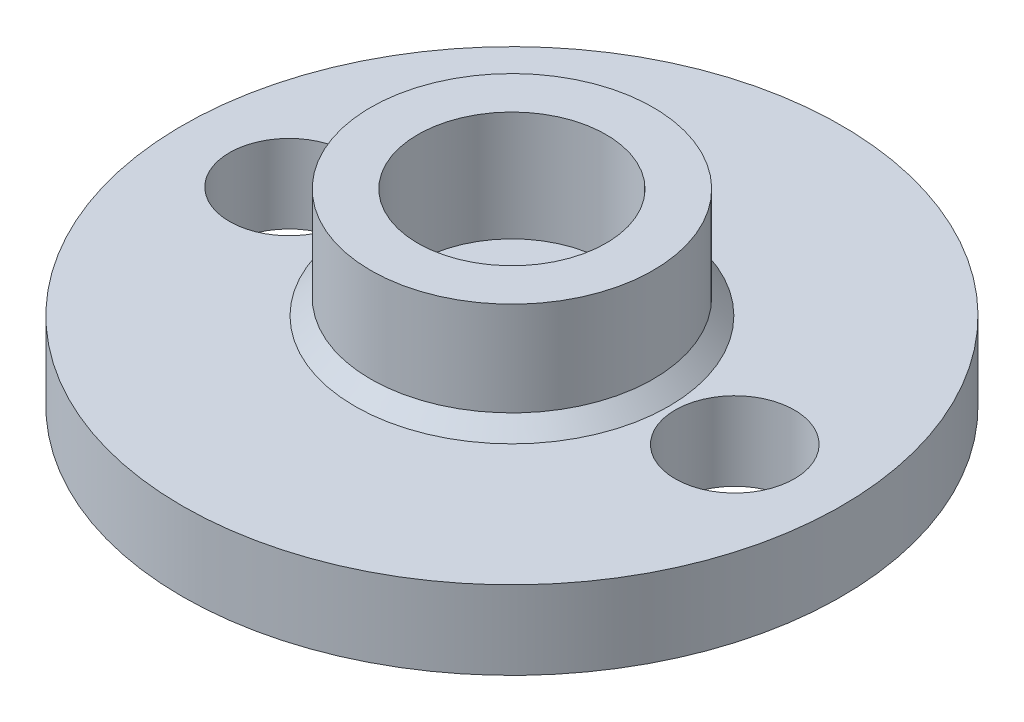
from build123d import *

# Parameters (mm, degrees)
SKETCH1_R               = 10.5
BOSS_EXTRUDE1_DEPTH     = 2.5
SKETCH2_R               = 4.5
SKETCH2_R_2             = 3
BOSS_EXTRUDE2_DEPTH     = 3.5
SKETCH4_R               = 1.5
CUT_EXTRUDE1_DEPTH      = 3.5
CUT_EXTRUDE2_DEPTH      = 16.256146302
CUT_EXTRUDE2_DEPTH_BACK = 16.256146302
SKETCH5_R               = 1.9
CHAMFER1_SIZE           = 0.5


with BuildPart() as part:
    # Sketch1 → Boss-Extrude1 (new body)
    with BuildSketch(Plane(origin=(0, 0, 0), x_dir=(1, 0, 0), z_dir=(0, 1, 0))):
        with Locations(Location((0, 0, 0), (0, 0, 270))):
            Circle(SKETCH1_R)
    extrude(amount=BOSS_EXTRUDE1_DEPTH)

    # Sketch2 → Boss-Extrude2 (add)
    with BuildSketch(Plane(origin=(0, 2.5, 0), x_dir=(1, 0, 0), z_dir=(0, 1, 0))):
        with Locations(Location((0, 0, 0), (0, 0, 270))):
            Circle(SKETCH2_R)
        with Locations(Location((0, 0, 0), (0, 0, 270))):
            Circle(SKETCH2_R_2, mode=Mode.SUBTRACT)
    extrude(amount=BOSS_EXTRUDE2_DEPTH)

    # Sketch4 → Cut-Extrude1 (cut)
    with BuildSketch(Plane(origin=(0, 2.5, 0), x_dir=(1, 0, 0), z_dir=(0, 1, 0))):
        with Locations(Location((0, 0, 0), (0, 0, 270))):
            Circle(SKETCH4_R)
    extrude(amount=-CUT_EXTRUDE1_DEPTH, mode=Mode.SUBTRACT)

    # Sketch5 → Cut-Extrude2 (cut, two sides: drawn at the far end of the back side and taken through both)
    with BuildSketch(Plane(origin=(0, 2.5, 0), x_dir=(1, 0, 0), z_dir=(0, 1, 0)).offset(-CUT_EXTRUDE2_DEPTH_BACK)):
        with Locations(Location((-7.1, 0, 0), (0, 0, 270))):
            Circle(SKETCH5_R)
        with Locations(Location((7.1, 0, 0), (0, 0, 270))):
            Circle(SKETCH5_R)
    extrude(amount=CUT_EXTRUDE2_DEPTH + CUT_EXTRUDE2_DEPTH_BACK, mode=Mode.SUBTRACT)

    # Chamfer1
    chamfer1_edges = [part.edges().sort_by_distance(p)[0] for p in [
        (0, 2.5, -4.5),
    ]]
    chamfer(chamfer1_edges, length=CHAMFER1_SIZE)


solid = part.part
